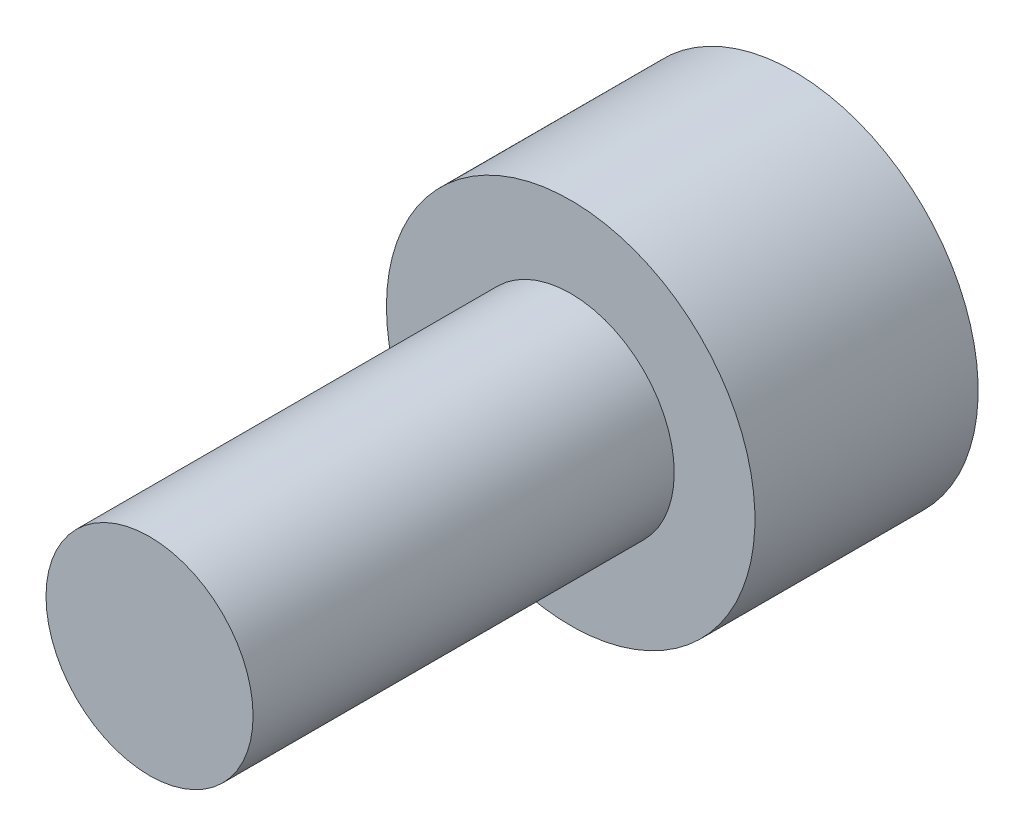
from build123d import *

# Parameters (mm, degrees)
SKETCH1_R           = 2.625
BOSS_EXTRUDE1_DEPTH = 3.18
SKETCH2_R           = 1.475
BOSS_EXTRUDE2_DEPTH = 6


with BuildPart() as part:
    # Sketch1 → Boss-Extrude1 (new body)
    with BuildSketch(Plane.XY):
        with Locations(Location((0, 0, 0), (0, 0, 180))):
            Circle(SKETCH1_R)
    extrude(amount=BOSS_EXTRUDE1_DEPTH)

    # Sketch2 → Boss-Extrude2 (add)
    with BuildSketch(Plane.XY.offset(3.18)):
        Circle(SKETCH2_R)
    extrude(amount=BOSS_EXTRUDE2_DEPTH)


solid = part.part
